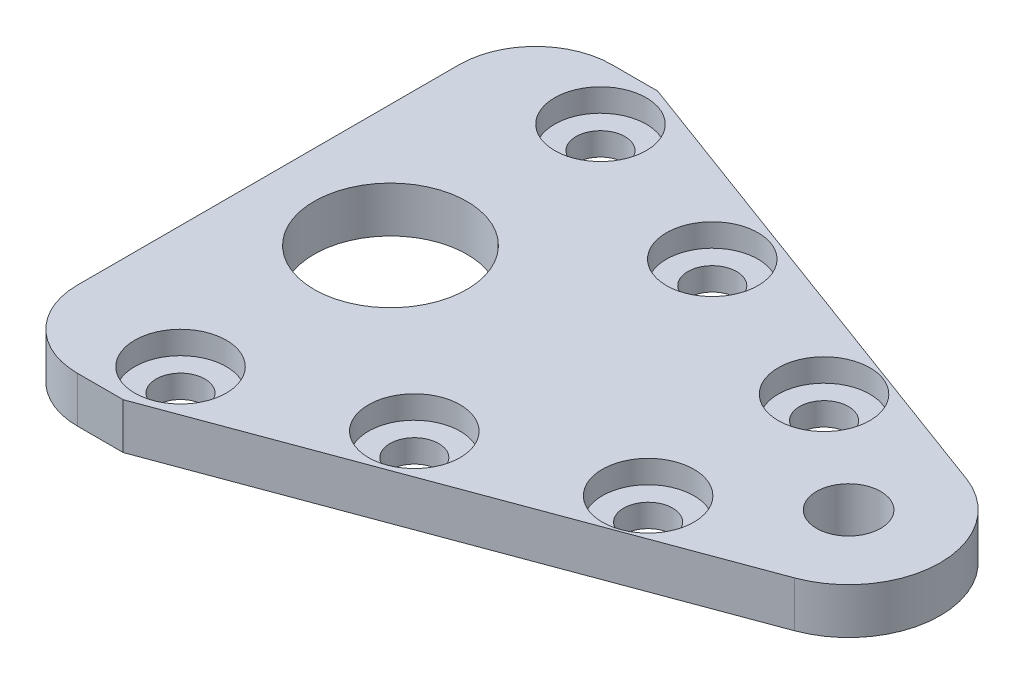
from build123d import *

# Parameters (mm, degrees)
SKETCH1_R           = 2.1
SKETCH1_R_2         = 5
BOSS_EXTRUDE1_DEPTH = 3
SKETCH3_R           = 1.6
CUT_EXTRUDE1_DEPTH  = 10
FILLET1_R           = 5
SKETCH4_R           = 3
CUT_EXTRUDE2_DEPTH  = 1.5


with BuildPart() as part:
    # Sketch1 → Boss-Extrude1 (new body)
    with BuildSketch(Plane(origin=(0, 0, 0), x_dir=(1, 0, 0), z_dir=(0, 1, 0))):
        with BuildLine():
            Line((-8, 17.5), (-8, -17.5))
            Line((-8, -17.5), (0, -17.5))
            Line((0, -17.5), (32.082434223, -5.627030097))
            ThreePointArc((32.082434223, -5.627030097), (36, 0), (32.082434223, 5.627030097))
            Line((32.082434223, 5.627030097), (0, 17.5))
            Line((0, 17.5), (-8, 17.5))
        make_face()
        with Locations(Location((30, 0, 0), (0, 0, 270))):
            Circle(SKETCH1_R, mode=Mode.SUBTRACT)
        with Locations(Location((0, 0, 0), (0, 0, 270))):
            Circle(SKETCH1_R_2, mode=Mode.SUBTRACT)
    extrude(amount=BOSS_EXTRUDE1_DEPTH)

    # Sketch3 → Cut-Extrude1 (cut)
    with BuildSketch(Plane(origin=(0, 3, 0), x_dir=(1, 0, 0), z_dir=(0, 1, 0))):
        with Locations(Location((0, 13.75, 0), (0, 0, 270))):
            Circle(SKETCH3_R)
        with Locations(Location((11.315438541, 9.754896669, 0), (0, 0, 270))):
            Circle(SKETCH3_R)
        with Locations(Location((22.630877082, 5.759793337, 0), (0, 0, 270))):
            Circle(SKETCH3_R)
        with Locations(Location((22.630877082, -5.759793337, 0), (0, 0, 270))):
            Circle(SKETCH3_R)
        with Locations(Location((0, -13.75, 0), (0, 0, 270))):
            Circle(SKETCH3_R)
        with Locations(Location((11.315438541, -9.754896669, 0), (0, 0, 270))):
            Circle(SKETCH3_R)
    extrude(amount=-CUT_EXTRUDE1_DEPTH, mode=Mode.SUBTRACT)

    # Fillet1
    fillet1_edges = [part.edges().sort_by_distance(p)[0] for p in [
        (-8, 1.5, 17.5),
        (-8, 1.5, -17.5),
    ]]
    fillet(fillet1_edges, radius=FILLET1_R)

    # Sketch4 → Cut-Extrude2 (cut)
    with BuildSketch(Plane(origin=(0, 3, 0), x_dir=(1, 0, 0), z_dir=(0, 1, 0))):
        with Locations(Location((0, 13.75, 0), (0, 0, 270))):
            Circle(SKETCH4_R)
        with Locations(Location((11.315438541, 9.754896669, 0), (0, 0, 270))):
            Circle(SKETCH4_R)
        with Locations(Location((22.630877082, 5.759793337, 0), (0, 0, 270))):
            Circle(SKETCH4_R)
        with Locations(Location((22.630877082, -5.759793337, 0), (0, 0, 270))):
            Circle(SKETCH4_R)
        with Locations(Location((11.315438541, -9.754896669, 0), (0, 0, 270))):
            Circle(SKETCH4_R)
        with Locations(Location((0, -13.75, 0), (0, 0, 270))):
            Circle(SKETCH4_R)
    extrude(amount=-CUT_EXTRUDE2_DEPTH, mode=Mode.SUBTRACT)


solid = part.part
